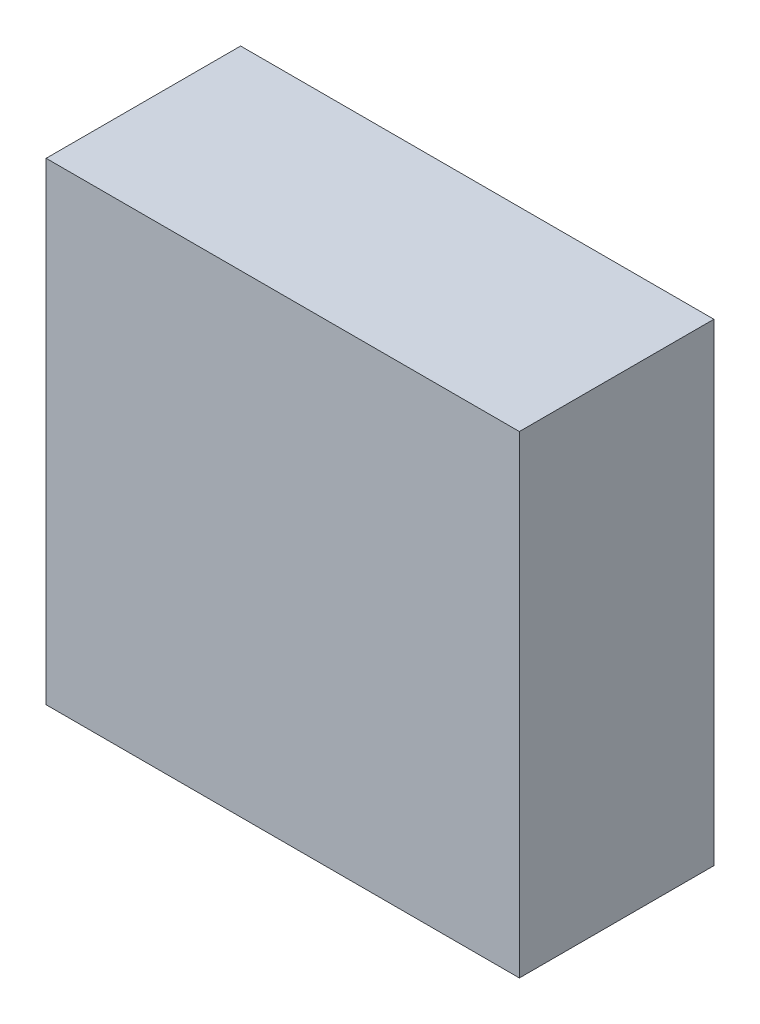
from build123d import *

# Parameters (mm, degrees)
SKETCH1_W           = 185.42
SKETCH1_H           = 76.2
BOSS_EXTRUDE1_DEPTH = 185.42


with BuildPart() as part:
    # Sketch1 → Boss-Extrude1 (new body)
    with BuildSketch(Plane(origin=(0, 0, 0), x_dir=(1, 0, 0), z_dir=(0, 1, 0))):
        with Locations((92.71, 38.1)):
            Rectangle(SKETCH1_W, SKETCH1_H)
    extrude(amount=BOSS_EXTRUDE1_DEPTH)


solid = part.part
